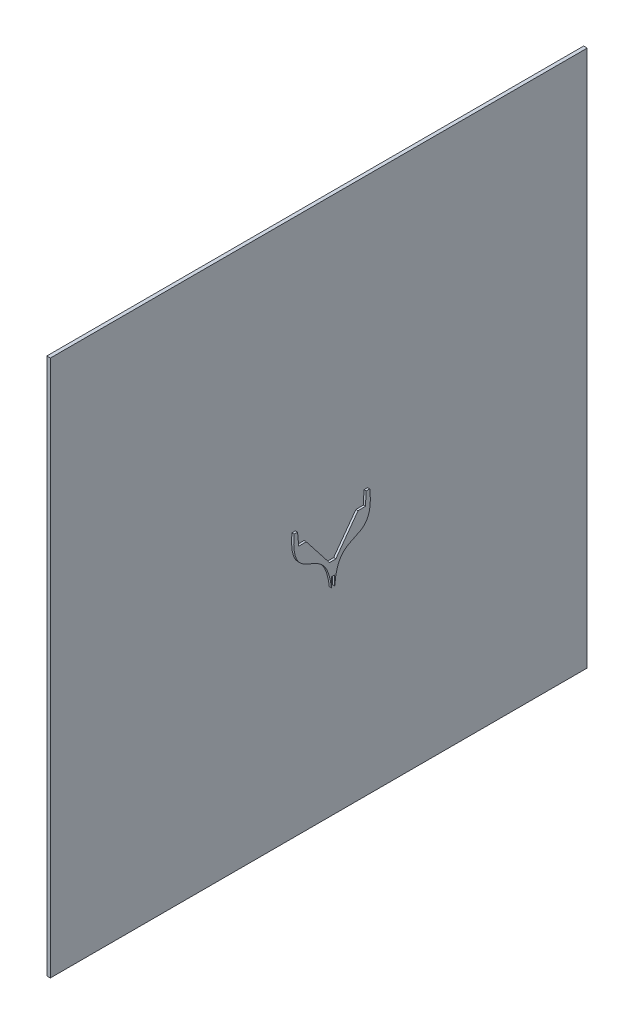
from build123d import *

# Parameters (mm, degrees)
BOSS_EXTRU_2_DEPTH      = 10
BOSS_EXTRU_3_DEPTH      = 6
ENL_V_MAT_EXTRU_1_DEPTH = 6


with BuildPart() as part:
    # Esquisse3D1 → Boss.-Extru.2 (new body)
    with BuildSketch(Plane(origin=(-20, 1121.289346724, 777.274991403), x_dir=(0, -0.7071067811865476, -0.7071067811865476), z_dir=(1, 0, 0))):
        Polygon((0, 0), (1060.66017178, 1060.66017178), (2121.32034356, 0), (1060.66017178, -1060.66017178), align=None)
    extrude(amount=BOSS_EXTRU_2_DEPTH)


with BuildPart() as body_2:
    # Esquisse5 → Boss.-Extru.3 (new body)
    with BuildSketch(Plane(origin=(0, 0, 0), x_dir=(0, 0, -1), z_dir=(1, 0, 0))):
        with BuildLine():
            Line((-8.104342583, 252.474437856), (-1.045313335, 252.602314833))
            Line((-1.045313335, 252.602314833), (4.241642527, 252.698090033))
            Line((4.241642527, 252.698090033), (66.327362258, 338.046023845))
            Line((66.327362258, 338.046023845), (87.118425546, 338.4226618))
            Line((87.118425546, 338.4226618), (89.094192112, 374.475874746))
            Line((89.094192112, 374.475874746), (99.094192112, 374.657028519))
            add(Edge.make_bspline(
                [(0, 0), (13.241353905, 145.149025234), (-56.44530803, 383.771712272), (120.215562295, 187.351690566), (99.094192112, 374.657028519)],
                knots=[0, 0, 0, 0, 0, 1, 1, 1, 1, 1], degree=4))
            add(Edge.make_bspline(
                [(0, 0), (-18.489799491, 144.574203419), (42.508495971, 385.564297763), (-126.922352922, 182.874693997), (-112.598828297, 370.822129592)],
                knots=[0, 0, 0, 0, 0, 1, 1, 1, 1, 1], degree=4))
            Line((-112.598828297, 370.822129592), (-102.598828297, 371.003283364))
            Line((-102.598828297, 371.003283364), (-99.318551483, 335.045285627))
            Line((-99.318551483, 335.045285627), (-78.527488195, 335.421923582))
            Line((-78.527488195, 335.421923582), (-13.391298445, 252.378662656))
            Line((-13.391298445, 252.378662656), (-8.104342583, 252.474437856))
        make_face()
    extrude(amount=BOSS_EXTRU_3_DEPTH)

    # Esquisse6 → Enlèv. mat.-Extru.1 (cut)
    with BuildSketch(Plane(origin=(6, 0, 0), x_dir=(0, 0, -1), z_dir=(1, 0, 0))):
        Polygon((-7.914172437, 188.386674922), (-8.403287623, 215.386674922), (0.596712377, 215.549713317), (1.085827563, 188.549713317), (117.063261114, -47.52702125), (-85.227699586, -65.220017949), align=None)
    extrude(amount=-ENL_V_MAT_EXTRU_1_DEPTH, mode=Mode.SUBTRACT)


solid = Compound([part.part, body_2.part])
